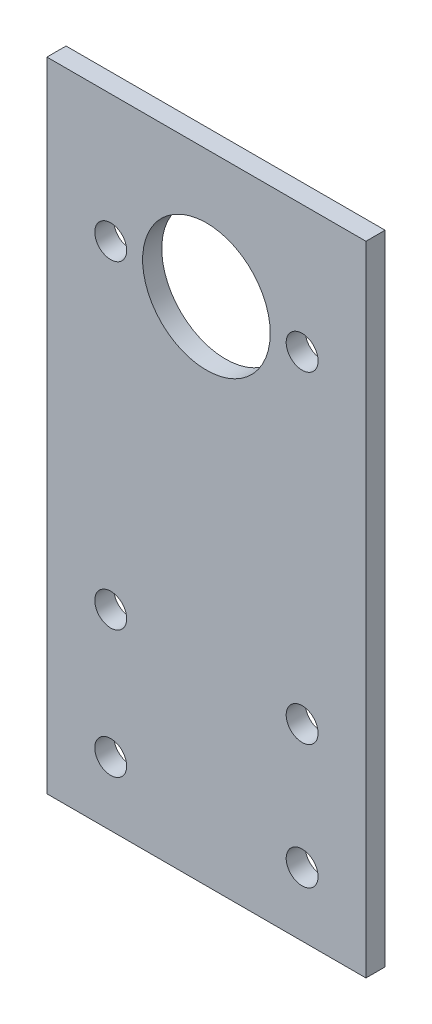
from build123d import *

# Parameters (mm, degrees)
SZKIC1_W                    = 50
SZKIC1_H                    = 100
SZKIC1_R                    = 2.5
DODANIE_WYCI_GNI_CIE1_DEPTH = 3
SZKIC2_R                    = 10
SZKIC2_R_2                  = 2.5
WYTNIJ_WYCI_GNI_CIE1_DEPTH  = 3


with BuildPart() as part:
    # Szkic1 → Dodanie-wyciągnięcie1 (new body)
    with BuildSketch(Plane.XY):
        with Locations((8.216170281, 6.009174312)):
            Rectangle(SZKIC1_W, SZKIC1_H)
        with Locations((23.216170281, -33.990825688)):
            Circle(SZKIC1_R, mode=Mode.SUBTRACT)
        with Locations((-6.783829719, -33.990825688)):
            Circle(SZKIC1_R, mode=Mode.SUBTRACT)
        with Locations((23.216170281, -14.524318973)):
            Circle(SZKIC1_R, mode=Mode.SUBTRACT)
        with Locations((-6.783829719, -13.990825688)):
            Circle(SZKIC1_R, mode=Mode.SUBTRACT)
    extrude(amount=DODANIE_WYCI_GNI_CIE1_DEPTH)

    # Szkic2 → Wytnij-wyciągnięcie1 (cut)
    with BuildSketch(Plane.XY.offset(3)):
        with Locations((8.216170281, 36.009174312)):
            Circle(SZKIC2_R)
        with Locations((-6.783829719, 36.009174312)):
            Circle(SZKIC2_R_2)
        with Locations((23.216170281, 36.009174312)):
            Circle(SZKIC2_R_2)
    extrude(amount=-WYTNIJ_WYCI_GNI_CIE1_DEPTH, mode=Mode.SUBTRACT)


solid = part.part
